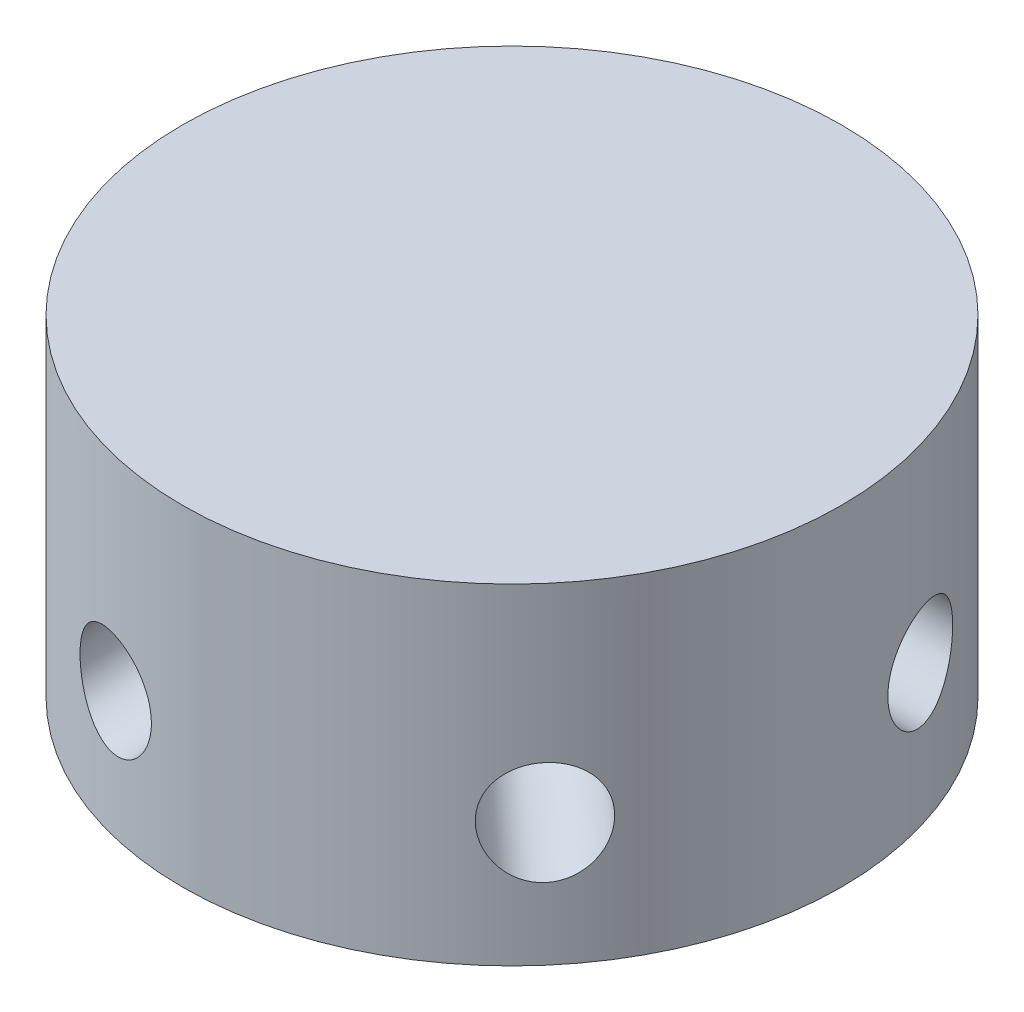
from build123d import *

# Parameters (mm, degrees)
BASE_DEPTH          = 3.035432218
BASE_DEPTH_BACK     = 7
SKETCH1_R           = 10
SKETCH3_R           = 1.5
HOLE2_DEPTH         = 19.445737436
HOLE2MIRROR_COUNT   = 2
SKETCH4_R           = 1.5
HOLE3_DEPTH         = 19.389503466
SKETCH5_R           = 1.5
CUT_EXTRUDE1_DEPTH  = 19.60459576
SKETCH6_R           = 1.5
CUT_EXTRUDE2_DEPTH  = 19.841947755
SKETCH7_R           = 1.5
CUT_EXTRUDE3_DEPTH  = 19.934353442
SKETCH9_W           = 1.346153846
SKETCH9_H           = 0.358974359
BOSS_EXTRUDE1_DEPTH = 1


with BuildPart() as part:
    # Sketch1 → base (new, two sides: drawn at the far end of the back side and taken through both)
    with BuildSketch(Plane(origin=(0, 0, 0), x_dir=(1, 0, 0), z_dir=(0, 1, 0)).offset(-BASE_DEPTH_BACK)):
        Circle(SKETCH1_R)
    extrude(amount=BASE_DEPTH + BASE_DEPTH_BACK)

    # Sketch3 → hole2 (cut, through all)
    with BuildSketch(Plane(origin=(-0.941672921, -1.236067977, 3.685836142), x_dir=(-0.9718935871364875, 0.07382318789513377, -0.22354639834264944), z_dir=(0.23541823021467095, 0.3090169943749464, -0.921459035481267))):
        Circle(SKETCH3_R)
    hole2 = extrude(amount=-HOLE2_DEPTH, mode=Mode.SUBTRACT)

    # hole2mirror: hole2 ×2 about axis
    hole2mirror_axis = Axis((0, 5.5, 0), (0, -1, 0))
    for i in range(1, HOLE2MIRROR_COUNT):
        add(hole2.rotate(hole2mirror_axis, i * 360 / HOLE2MIRROR_COUNT), mode=Mode.SUBTRACT)

    # Sketch4 → hole3 (cut, through all)
    with BuildSketch(Plane(origin=(-3.717841, -1.236067977, 0.806098168), x_dir=(-0.19123247894507908, -0.06357892752956036, -0.979483465389136), z_dir=(0.9294602499075393, 0.30901699437494623, -0.20152454200243008))):
        Circle(SKETCH4_R)
    extrude(amount=-HOLE3_DEPTH, mode=Mode.SUBTRACT)

    # Sketch5 → Cut-Extrude1 (cut, through all)
    with BuildSketch(Plane(origin=(3.671965021, -1.093066116, -1.149730122), x_dir=(0.2754858058396647, -0.08200628219437099, 0.9578008876909271), z_dir=(-0.9179912552075574, 0.27326652891267317, 0.2874325304110031))):
        Circle(SKETCH5_R)
    extrude(amount=-CUT_EXTRUDE1_DEPTH, mode=Mode.SUBTRACT)

    # Sketch6 → Cut-Extrude2 (cut, through all)
    with BuildSketch(Plane(origin=(2.875583134, -1.236067977, 2.490613899), x_dir=(-0.5720437997755544, 0.24589274231852376, 0.782497699941298), z_dir=(-0.7188957835464718, 0.30901699437494723, -0.6226534747245682))):
        Circle(SKETCH6_R)
    extrude(amount=-CUT_EXTRUDE2_DEPTH, mode=Mode.SUBTRACT)

    # Sketch7 → Cut-Extrude3 (cut, through all)
    with BuildSketch(Plane(origin=(-2.670502563, -1.093066116, -2.770130417), x_dir=(0.7444971483747472, -0.2450509606833859, -0.6210265877802813), z_dir=(0.6676256406564008, 0.2732665289126714, 0.6925326043690294))):
        Circle(SKETCH7_R)
    extrude(amount=-CUT_EXTRUDE3_DEPTH, mode=Mode.SUBTRACT)

    # Sketch9 → Boss-Extrude1 (add)
    # profile 1 of 3: a face of its own
    with BuildSketch(Plane.XZ.offset(7)):
        with BuildLine():
            Line((-1.75, 3.58974359), (-1.508112981, 3.399739583))
            Line((-1.508112981, 3.399739583), (-2.432892628, 1.985576923))
            add(Edge.make_bspline(
                [(-2.432892628, 1.985576923), (-2.371322351, 1.995390784), (-2.251222564, 2.014533829), (-2.129656666, 2.017691774), (-2.07041266, 2.019230769)],
                knots=[0, 0, 0, 0, 1.025318673, 2, 2, 2, 2], degree=3))
            add(Edge.make_bspline(
                [(-2.07041266, 2.019230769), (-2.034840164, 2.018274658), (-1.964816763, 2.01639258), (-1.862009961, 2.001908729), (-1.763221025, 1.979083617), (-1.668859413, 1.945811362), (-1.578586431, 1.903309007), (-1.491884035, 1.852370137), (-1.410382025, 1.790364457), (-1.333030846, 1.721099501), (-1.262803748, 1.644382516), (-1.200627693, 1.56298118), (-1.148400901, 1.476980299), (-1.106026979, 1.386423433), (-1.073122101, 1.291450173), (-1.049134456, 1.192182034), (-1.034954863, 1.088550562), (-1.033029372, 1.018072387), (-1.032051282, 0.982271635)],
                knots=[0, 0, 0, 0, 1.04369286, 2.054478336, 3.041073146, 4.015093852, 4.984733326, 5.965804835, 6.960378782, 7.985147595, 9.009457201, 10.008161701, 10.986880575, 11.956520048, 12.937015923, 13.931873656, 14.949455224, 16, 16, 16, 16], degree=3))
            add(Edge.make_bspline(
                [(-1.032051282, 0.982271635), (-1.033474387, 0.933291931), (-1.036274721, 0.836911465), (-1.064178517, 0.696534758), (-1.107538161, 0.562802243), (-1.16951569, 0.437849071), (-1.246498073, 0.321846502), (-1.340375665, 0.219061036), (-1.447819154, 0.127390999), (-1.569305952, 0.05073438), (-1.700048916, -0.011868671), (-1.837400913, -0.056833913), (-1.98002806, -0.084517383), (-2.076832668, -0.087987985), (-2.125801282, -0.08974359)],
                knots=[0, 0, 0, 0, 1.031375318, 2.029502543, 3.004789286, 3.987476834, 4.960371455, 5.9300674, 6.912260825, 7.929083631, 8.949397511, 9.960523116, 10.96833055, 12, 12, 12, 12], degree=3))
            add(Edge.make_bspline(
                [(-2.125801282, -0.08974359), (-2.172897983, -0.088215384), (-2.266188301, -0.085188276), (-2.403421095, -0.058222338), (-2.535284112, -0.014515235), (-2.660853493, 0.045699043), (-2.777174106, 0.121756926), (-2.881239743, 0.213319205), (-2.972531517, 0.31842867), (-3.048506138, 0.437069018), (-3.10876487, 0.564558975), (-3.153954795, 0.697496132), (-3.180351038, 0.835396113), (-3.184039595, 0.928877252), (-3.185897436, 0.975961538)],
                knots=[0, 0, 0, 0, 1.012016664, 2.004627821, 2.994792927, 3.992885782, 4.990978636, 5.973936114, 6.964471063, 7.975201453, 8.993600317, 9.990122807, 10.98767138, 12, 12, 12, 12], degree=3))
            add(Edge.make_bspline(
                [(-3.185897436, 0.975961538), (-3.184715991, 1.012006122), (-3.182303706, 1.085602274), (-3.165460316, 1.197066302), (-3.138395521, 1.311117383), (-3.108085274, 1.407871577), (-3.076059664, 1.487133099), (-3.049407125, 1.55103659), (-3.016233129, 1.616797663), (-2.980859748, 1.686671299), (-2.940102879, 1.758856731), (-2.895787229, 1.834560401), (-2.846687578, 1.912578329), (-2.812267416, 1.965522524), (-2.794671474, 1.992588141)],
                knots=[0, 0, 0, 0, 1.173818275, 2.396712641, 3.66331629, 4.989737886, 5.693666774, 6.447286557, 7.243889047, 8.091586357, 8.998013824, 9.943181721, 10.948533338, 12, 12, 12, 12], degree=3))
            Line((-2.794671474, 1.992588141), (-1.75, 3.58974359))
        make_face()
        with BuildLine():
            add(Edge.make_bspline(
                [(-2.136318109, 1.66025641), (-2.162980354, 1.659478367), (-2.215059463, 1.657958621), (-2.291466878, 1.649133369), (-2.363780129, 1.632514304), (-2.432957263, 1.611347972), (-2.497704966, 1.582244912), (-2.558493806, 1.546893113), (-2.615558858, 1.505271935), (-2.668302409, 1.457971024), (-2.716122073, 1.406182991), (-2.757303204, 1.350713469), (-2.792825604, 1.292899266), (-2.821707422, 1.232257323), (-2.844197498, 1.168810824), (-2.860465749, 1.102851574), (-2.8695195, 1.033937268), (-2.871025732, 0.987204766), (-2.871794872, 0.963341346)],
                knots=[0, 0, 0, 0, 1.129588631, 2.206414736, 3.251139165, 4.268635594, 5.265702196, 6.250456724, 7.242448911, 8.251968645, 9.246821453, 10.222880186, 11.173611482, 12.116736599, 13.062300278, 14.020270554, 14.989073742, 16, 16, 16, 16], degree=3))
            add(Edge.make_bspline(
                [(-2.871794872, 0.963341346), (-2.87116851, 0.939691366), (-2.869940309, 0.893317277), (-2.858787989, 0.824978097), (-2.841752907, 0.759213189), (-2.816412511, 0.69636159), (-2.786185622, 0.635465272), (-2.746280298, 0.578729986), (-2.702063512, 0.522709916), (-2.649209579, 0.471708445), (-2.592486216, 0.424251821), (-2.531885014, 0.382771567), (-2.468725054, 0.347285394), (-2.402153632, 0.319474296), (-2.333115248, 0.296650009), (-2.261034694, 0.28058853), (-2.185861838, 0.271508004), (-2.1349399, 0.26999981), (-2.108974359, 0.269230769)],
                knots=[0, 0, 0, 0, 0.989467248, 1.94019797, 2.891935182, 3.827694429, 4.772920941, 5.730924762, 6.725747692, 7.756678648, 8.79901574, 9.819492441, 10.826891316, 11.826466727, 12.835195252, 13.867842842, 14.912794438, 16, 16, 16, 16], degree=3))
            add(Edge.make_bspline(
                [(-2.108974359, 0.269230769), (-2.08300886, 0.269999871), (-2.032087006, 0.271508182), (-1.956913546, 0.280587851), (-1.884835227, 0.296652499), (-1.815788718, 0.31946527), (-1.749247287, 0.347318879), (-1.686142566, 0.382550799), (-1.626114472, 0.424506917), (-1.569353873, 0.471627345), (-1.516719934, 0.523000197), (-1.471442656, 0.578229919), (-1.432759422, 0.635923815), (-1.401325235, 0.696121704), (-1.376263944, 0.759251192), (-1.359142477, 0.824967916), (-1.348013188, 0.893319942), (-1.346781822, 0.939692266), (-1.346153846, 0.963341346)],
                knots=[0, 0, 0, 0, 1.087397944, 2.132534446, 3.165364764, 4.174271784, 5.174024072, 6.181601208, 7.194203697, 8.236725232, 9.267838612, 10.269026844, 11.221737037, 12.171628256, 13.107553087, 14.05945871, 15.010357665, 16, 16, 16, 16], degree=3))
            add(Edge.make_bspline(
                [(-1.346153846, 0.963341346), (-1.346704139, 0.987235897), (-1.347784185, 1.03413313), (-1.360000134, 1.102820748), (-1.376942508, 1.169145954), (-1.402525538, 1.232691903), (-1.435762083, 1.29320783), (-1.47624549, 1.350999431), (-1.523078061, 1.406509779), (-1.5771756, 1.458072587), (-1.636065834, 1.505219665), (-1.698681419, 1.546839221), (-1.764189393, 1.581964198), (-1.832523336, 1.6112713), (-1.904466218, 1.632420774), (-1.978856557, 1.649074017), (-2.0566458, 1.657936035), (-2.109422408, 1.6594731), (-2.136318109, 1.66025641)],
                knots=[0, 0, 0, 0, 0.978206639, 1.919901502, 2.851605144, 3.780102724, 4.718870031, 5.675451981, 6.667674623, 7.690630536, 8.733308323, 9.756129687, 10.767539656, 11.776269907, 12.797430371, 13.836405707, 14.897401972, 16, 16, 16, 16], degree=3))
        make_face(mode=Mode.SUBTRACT)
    # profile 2 of 3: a face of its own
    with BuildSketch(Plane.XZ.offset(7)):
        with Locations((0, 1.346153847)):
            Rectangle(SKETCH9_W, SKETCH9_H)
    # profile 3 of 3: a face of its own
    with BuildSketch(Plane.XZ.offset(7)):
        with BuildLine():
            Line((1.391025641, 2.423076923), (1.076923077, 2.423076923))
            add(Edge.make_bspline(
                [(1.076923077, 2.423076923), (1.07897023, 2.464747811), (1.082990784, 2.546588325), (1.101819073, 2.665912232), (1.12875995, 2.779967031), (1.166851404, 2.887836945), (1.214157682, 2.990475752), (1.27088771, 3.087475767), (1.33808156, 3.178466956), (1.414288294, 3.262605799), (1.497056933, 3.33979337), (1.586362873, 3.406448613), (1.6802079, 3.462766284), (1.778307299, 3.509847526), (1.881767862, 3.545187372), (1.98965072, 3.571409012), (2.102429857, 3.587185357), (2.179269879, 3.588881143), (2.218349359, 3.58974359)],
                knots=[0, 0, 0, 0, 1.10065271, 2.161652631, 3.183658789, 4.190468796, 5.17591951, 6.163126047, 7.15150782, 8.156236427, 9.156009102, 10.134482811, 11.092018607, 12.041330605, 13.001268258, 13.972401359, 14.968799086, 16, 16, 16, 16], degree=3))
            add(Edge.make_bspline(
                [(2.218349359, 3.58974359), (2.256727433, 3.588845133), (2.332138978, 3.587079698), (2.442200992, 3.571918669), (2.546978287, 3.548173078), (2.646266053, 3.514857661), (2.739272118, 3.470073234), (2.826695162, 3.416275695), (2.909575973, 3.354055864), (2.984182757, 3.28080205), (3.052690836, 3.202599666), (3.111793091, 3.119111762), (3.162406255, 3.032882477), (3.204593934, 2.943254275), (3.235650073, 2.849383247), (3.259228281, 2.752636044), (3.272555695, 2.652011233), (3.274601119, 2.583904677), (3.275641026, 2.549278846)],
                knots=[0, 0, 0, 0, 1.111607364, 2.184268762, 3.212621178, 4.221274766, 5.211760367, 6.196651075, 7.1921475, 8.207485113, 9.220403448, 10.201281604, 11.166441695, 12.114753415, 13.065576456, 14.026450734, 14.996634279, 16, 16, 16, 16], degree=3))
            add(Edge.make_bspline(
                [(3.275641026, 2.549278846), (3.273947763, 2.500531012), (3.270590951, 2.403890798), (3.241876575, 2.261875935), (3.197030064, 2.124282516), (3.143032707, 2.013545214), (3.088560263, 1.92431172), (3.039472755, 1.850843015), (2.982007944, 1.771737547), (2.915329446, 1.68726021), (2.840816574, 1.596749304), (2.757794411, 1.500259509), (2.665670929, 1.398787739), (2.601012428, 1.329482138), (2.567508013, 1.293569712)],
                knots=[0, 0, 0, 0, 1.184426356, 2.348067706, 3.509069118, 4.696110526, 5.333549288, 6.050745305, 6.844228056, 7.710549037, 8.667450064, 9.695053472, 10.805634456, 12, 12, 12, 12], degree=3))
            Line((2.567508013, 1.293569712), (1.691806891, 0.358974359))
            Line((1.691806891, 0.358974359), (3.320512821, 0.358974359))
            Line((3.320512821, 0.358974359), (3.320512821, 0))
            Line((3.320512821, 0), (0.942307692, 0))
            Line((0.942307692, 0), (2.299679487, 1.448517628))
            add(Edge.make_bspline(
                [(2.299679487, 1.448517628), (2.332727374, 1.483015935), (2.396205601, 1.549280121), (2.485988178, 1.646023081), (2.566627166, 1.735772622), (2.638644559, 1.818359171), (2.700478064, 1.894990738), (2.755350296, 1.963185442), (2.799315887, 2.025939892), (2.847031283, 2.098680506), (2.893245264, 2.187492823), (2.93295762, 2.296026513), (2.957172469, 2.407753765), (2.960077304, 2.483255802), (2.961538462, 2.521233974)],
                knots=[0, 0, 0, 0, 1.329631726, 2.553950428, 3.673215718, 4.687767853, 5.603093632, 6.413772471, 7.123043292, 7.734684054, 8.834405432, 9.900288307, 10.943827018, 12, 12, 12, 12], degree=3))
            add(Edge.make_bspline(
                [(2.961538462, 2.521233974), (2.960902719, 2.545115373), (2.959649793, 2.592181023), (2.948592096, 2.661186782), (2.93188159, 2.727751596), (2.907936332, 2.792080215), (2.876329592, 2.853525867), (2.837856212, 2.912163347), (2.793466148, 2.968852313), (2.742114879, 3.022005611), (2.685703359, 3.070686816), (2.626109109, 3.113810902), (2.563059005, 3.149850012), (2.496818883, 3.179393509), (2.427573414, 3.202568891), (2.355188669, 3.21862747), (2.279864652, 3.228709954), (2.228431157, 3.230074126), (2.202223558, 3.230769231)],
                knots=[0, 0, 0, 0, 0.991446411, 1.95395049, 2.89581595, 3.838931463, 4.798493298, 5.75982156, 6.748411868, 7.785213223, 8.824556874, 9.840280684, 10.836137867, 11.835679398, 12.848801643, 13.863922112, 14.911575587, 16, 16, 16, 16], degree=3))
            add(Edge.make_bspline(
                [(2.202223558, 3.230769231), (2.174852725, 3.230054199), (2.121100929, 3.228649993), (2.042181896, 3.218827329), (1.966896118, 3.201881489), (1.895054215, 3.178704814), (1.826534629, 3.149246266), (1.761670585, 3.112554521), (1.700607696, 3.068771028), (1.643231173, 3.019130471), (1.590367194, 2.96386287), (1.543920318, 2.902252907), (1.503336304, 2.835425492), (1.46792707, 2.763560941), (1.43917138, 2.686007161), (1.41719823, 2.603039456), (1.399811383, 2.515018075), (1.394002862, 2.45423299), (1.391025641, 2.423076923)],
                knots=[0, 0, 0, 0, 1.031018746, 2.02475058, 2.990194455, 3.934040569, 4.864654155, 5.795059489, 6.735614925, 7.690564532, 8.649604399, 9.611025574, 10.590972636, 11.591080095, 12.624614302, 13.701020113, 14.821632451, 16, 16, 16, 16], degree=3))
        make_face()
    extrude(amount=BOSS_EXTRUDE1_DEPTH)


solid = part.part
